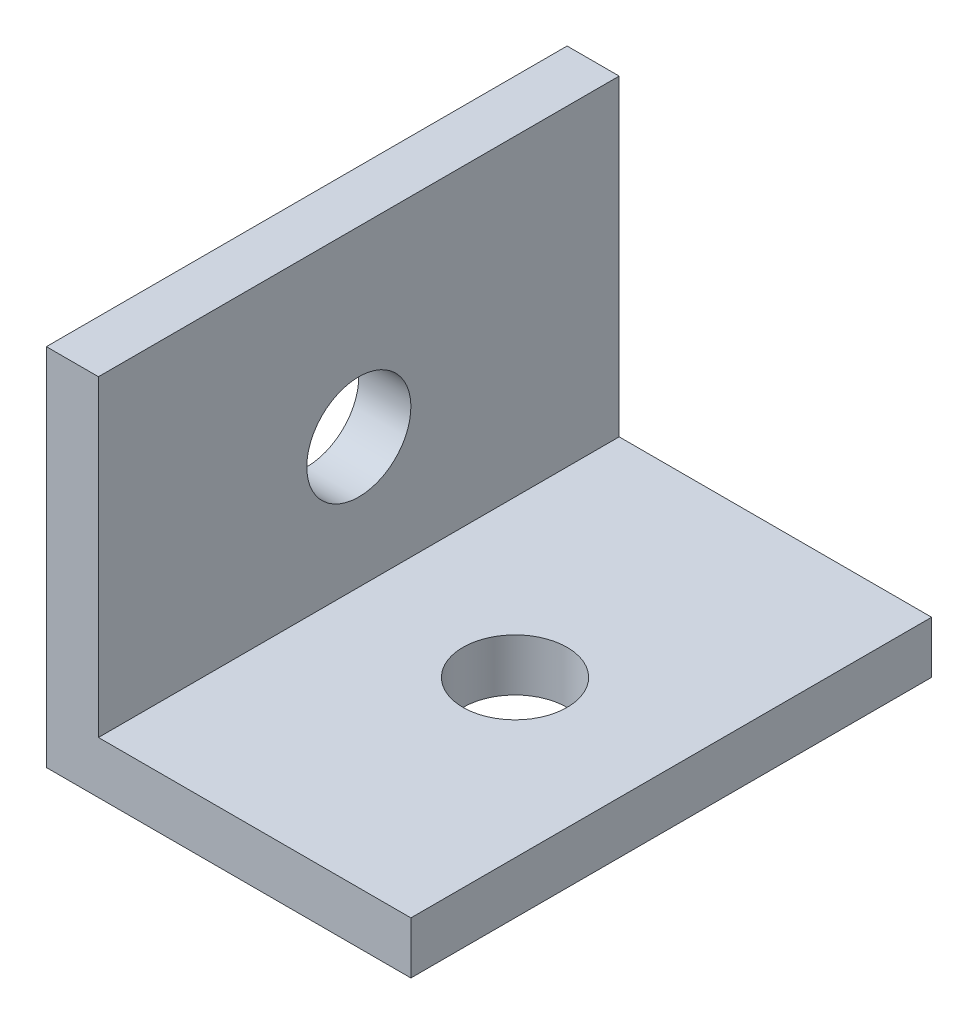
from build123d import *

# Parameters (mm, degrees)
BOSS_EXTRUDE1_DEPTH = 50
CUT_EXTRUDE1_DEPTH  = 71.356236397
CUT_EXTRUDE2_DEPTH  = 50


with BuildPart() as part:
    # Sketch1 → Boss-Extrude1 (new body)
    with BuildSketch(Plane.XY):
        Polygon((0, 0), (35, 0), (35, 5), (5, 5), (5, 35), (0, 35), align=None)
    extrude(amount=BOSS_EXTRUDE1_DEPTH)

    # Sketch3 → Cut-Extrude1 (cut, through all)
    with BuildSketch(Plane.ZY):
        with BuildLine():
            ThreePointArc((29.999165768, 17.5), (28.534944015, 21.034944015), (25, 22.499165768))
            Line((25, 22.499165768), (25, 12.500834232))
            ThreePointArc((25, 12.500834232), (28.534944015, 13.965055985), (29.999165768, 17.5))
        make_face()
        with BuildLine():
            Line((25, 12.500834232), (25, 22.499165768))
            ThreePointArc((25, 22.499165768), (20.000834232, 17.5), (25, 12.500834232))
        make_face()
    extrude(amount=-CUT_EXTRUDE1_DEPTH, mode=Mode.SUBTRACT)

    # Sketch2 → Cut-Extrude2 (cut)
    with BuildSketch(Plane(origin=(0, 5, 0), x_dir=(1, 0, 0), z_dir=(0, 1, 0))):
        with BuildLine():
            ThreePointArc((15, -25), (20, -30), (25, -25))
            Line((25, -25), (15, -25))
        make_face()
        with BuildLine():
            Line((15, -25), (25, -25))
            ThreePointArc((25, -25), (20, -20), (15, -25))
        make_face()
    extrude(amount=-CUT_EXTRUDE2_DEPTH, mode=Mode.SUBTRACT)


solid = part.part
